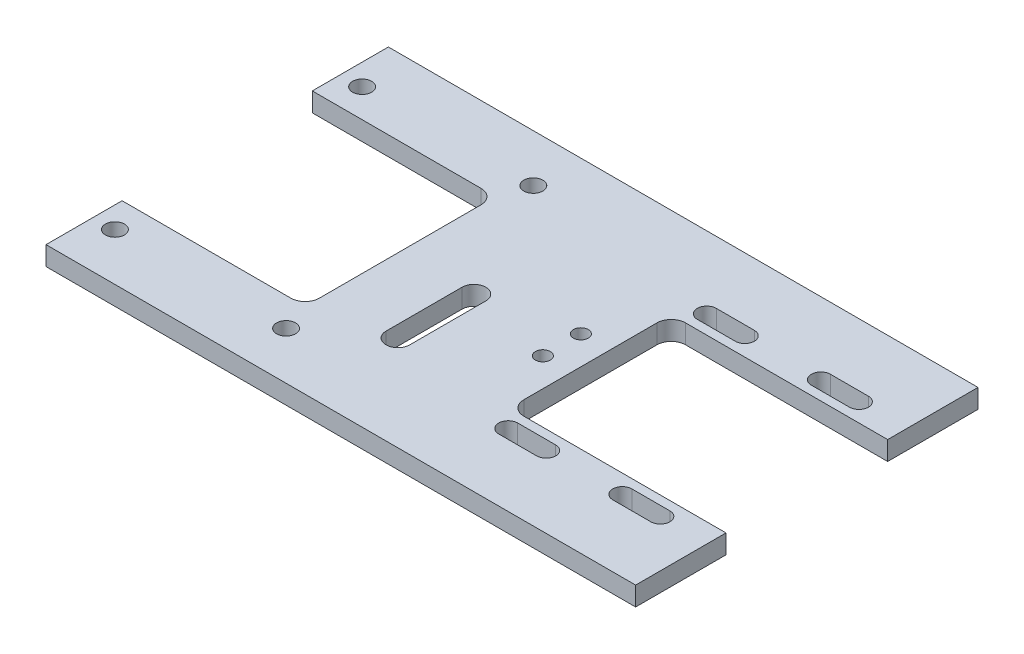
from build123d import *

# Parameters (mm, degrees)
SKETCH1_W           = 196.85
SKETCH1_H           = 114.3
SKETCH1_R           = 3.175
BOSS_EXTRUDE1_DEPTH = 6.35
CUT_EXTRUDE1_REACH  = 200.247
SKETCH7_W           = 72.25
SKETCH7_H           = 53.975
CUT_EXTRUDE3_DEPTH  = 6.35
CUT_EXTRUDE4_DEPTH  = 6.35
FILLET1_R           = 4.7625
SKETCH10_R          = 2.4892
CUT_EXTRUDE5_DEPTH  = 6.35


with BuildPart() as part:
    # Sketch1 → Boss-Extrude1 (new body)
    with BuildSketch(Plane(origin=(0, 0, 0), x_dir=(1, 0, 0), z_dir=(0, 1, 0))):
        with Locations((91.3, 0)):
            Rectangle(SKETCH1_W, SKETCH1_H)
        with Locations((0, 41.275)):
            Circle(SKETCH1_R, mode=Mode.SUBTRACT)
        with Locations((0, -41.275)):
            Circle(SKETCH1_R, mode=Mode.SUBTRACT)
        with Locations((57.15, 41.275)):
            Circle(SKETCH1_R, mode=Mode.SUBTRACT)
        with Locations((57.15, -41.275)):
            Circle(SKETCH1_R, mode=Mode.SUBTRACT)
    extrude(amount=BOSS_EXTRUDE1_DEPTH)

    # Sketch2 → Cut-Extrude1 (cut, up to next)
    with BuildSketch(Plane(origin=(0, 6.35, 0), x_dir=(1, 0, 0), z_dir=(0, 1, 0)), mode=Mode.PRIVATE) as cut_extrude1_sk1:
        Polygon((-7.125, 0), (-7.125, -31.75), (53.975, -31.75), (53.975, 0), (53.975, 31.75), (-7.125, 31.75), align=None)
    cut_extrude1_tool1 = extrude(cut_extrude1_sk1.sketch, amount=-CUT_EXTRUDE1_REACH, mode=Mode.PRIVATE) & part.part
    add(cut_extrude1_tool1.solids().sort_by_distance((23.425, 6.35, 0))[0], mode=Mode.SUBTRACT)

    # Sketch7 → Cut-Extrude3 (cut)
    with BuildSketch(Plane.XZ):
        with Locations((153.6, 0)):
            Rectangle(SKETCH7_W, SKETCH7_H)
    extrude(amount=-CUT_EXTRUDE3_DEPTH, mode=Mode.SUBTRACT)

    # Sketch9 → Cut-Extrude4 (cut)
    with BuildSketch(Plane(origin=(0, 6.35, 0), x_dir=(1, 0, 0), z_dir=(0, 1, 0))):
        with BuildLine():
            Line((135.875, -29.972), (123.175, -29.972))
            ThreePointArc((123.175, -29.972), (120, -33.147), (123.175, -36.322))
            Line((123.175, -36.322), (135.875, -36.322))
            ThreePointArc((135.875, -36.322), (139.05, -33.147), (135.875, -29.972))
        make_face()
        with BuildLine():
            Line((161.275, -36.322), (173.975, -36.322))
            ThreePointArc((173.975, -36.322), (177.15, -33.147), (173.975, -29.972))
            Line((173.975, -29.972), (161.275, -29.972))
            ThreePointArc((161.275, -29.972), (158.1, -33.147), (161.275, -36.322))
        make_face()
        with BuildLine():
            ThreePointArc((173.975, 36.322), (177.15, 33.147), (173.975, 29.972))
            Line((173.975, 29.972), (161.275, 29.972))
            ThreePointArc((161.275, 29.972), (158.1, 33.147), (161.275, 36.322))
            Line((161.275, 36.322), (173.975, 36.322))
        make_face()
        with BuildLine():
            ThreePointArc((123.175, 29.972), (120, 33.147), (123.175, 36.322))
            Line((123.175, 36.322), (135.875, 36.322))
            ThreePointArc((135.875, 36.322), (139.05, 33.147), (135.875, 29.972))
            Line((135.875, 29.972), (123.175, 29.972))
        make_face()
        with BuildLine():
            Line((74.63125, 0), (74.63125, -25.4))
            ThreePointArc((74.63125, -25.4), (78.6, -29.36875), (82.56875, -25.4))
            Line((82.56875, -25.4), (82.56875, 0))
            ThreePointArc((82.56875, 0), (78.6, 3.96875), (74.63125, 0))
        make_face()
    extrude(amount=-CUT_EXTRUDE4_DEPTH, mode=Mode.SUBTRACT)

    # Fillet1
    fillet1_edges = [part.edges().sort_by_distance(p)[0] for p in [
        (53.975, 3.175, 31.75),
        (53.975, 3.175, -31.75),
        (117.475, 3.175, 26.9875),
        (117.475, 3.175, -26.9875),
    ]]
    fillet(fillet1_edges, radius=FILLET1_R)

    # Sketch10 → Cut-Extrude5 (cut)
    with BuildSketch(Plane(origin=(0, 6.35, 0), x_dir=(1, 0, 0), z_dir=(0, 1, 0))):
        with Locations((107.95, -6.35)):
            Circle(SKETCH10_R)
        with Locations((107.95, 6.35)):
            Circle(SKETCH10_R)
    extrude(amount=-CUT_EXTRUDE5_DEPTH, mode=Mode.SUBTRACT)


solid = part.part
